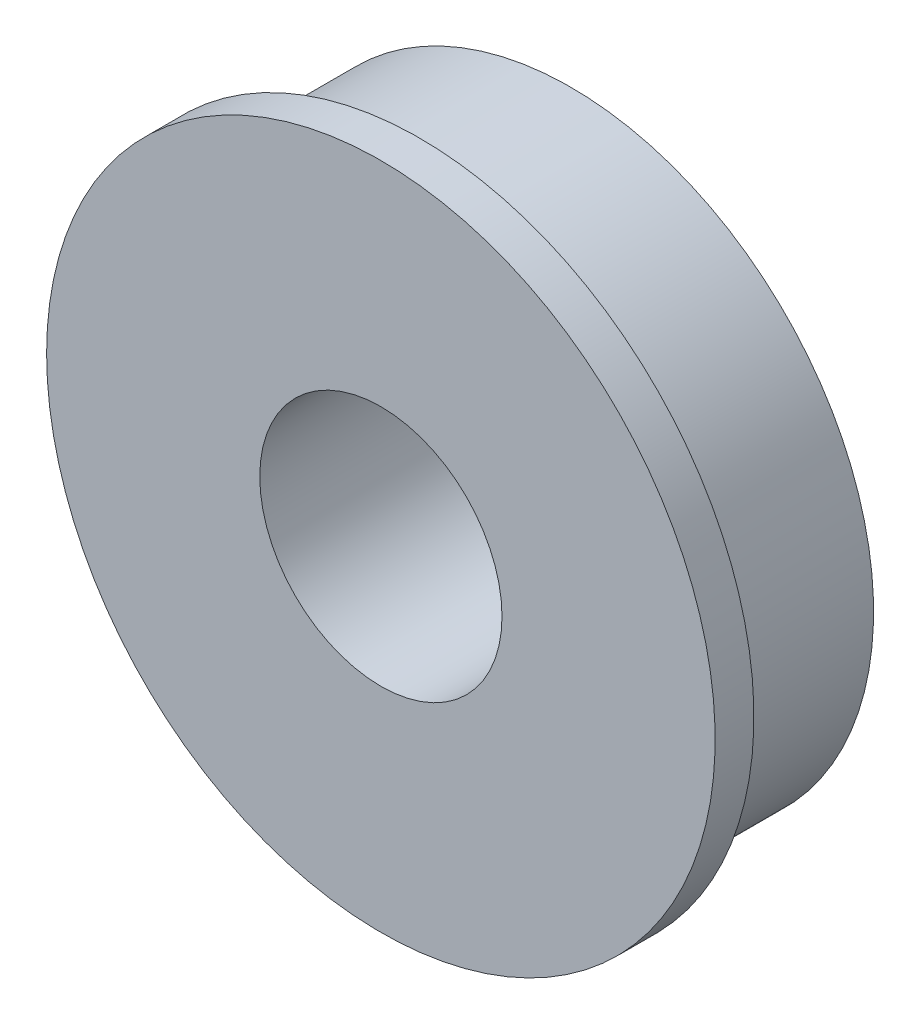
from build123d import *


with BuildPart() as part:
    # Sketch1 → Revolve1 (revolve)
    with BuildSketch(Plane(origin=(0, 0, 0), x_dir=(1, 0, 0), z_dir=(0, 1, 0))):
        Polygon((-38.708137827, 94.023403682), (-38.708137827, 99.001803682), (-43.470637827, 99.001803682), (-43.470637827, 95.039403682), (-38.708137827, 95.039403682), (-44.296137827, 95.039403682), (-44.296137827, 94.023403682), align=None)
    revolve(axis=Axis((-35.533137827, 0, -99.001803682), (0, 0, 1)))


solid = part.part
